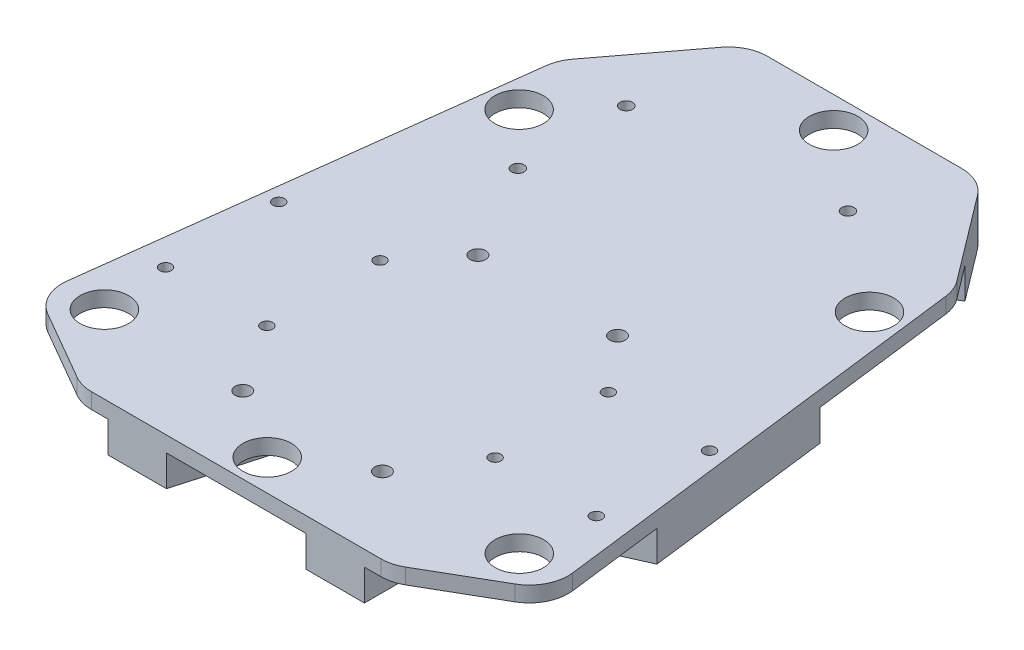
from build123d import *

# Parameters (mm, degrees)
SKETCH1_R           = 6.25
BOSS_EXTRUDE2_DEPTH = 12
SKETCH3_R           = 1.6
SKETCH3_R_2         = 2
SKETCH3_R_3         = 1.5
CUT_EXTRUDE3_DEPTH  = 194.554036966
SKETCH4_R           = 1.6
SKETCH4_R_2         = 6.25
SKETCH4_R_3         = 1.5
CUT_EXTRUDE4_DEPTH  = 8


with BuildPart() as part:
    # Sketch1 → Boss-Extrude2 (new body)
    with BuildSketch(Plane(origin=(0, 0, 0), x_dir=(1, 0, 0), z_dir=(0, 1, 0))):
        with BuildLine():
            Line((2.679491924, 0), (77.320508076, 0))
            ThreePointArc((77.320508076, 0), (79.908698527, 0.340741737), (82.320508076, 1.339745962))
            Line((82.320508076, 1.339745962), (100.238610908, 11.684767456))
            ThreePointArc((100.238610908, 11.684767456), (104.191551765, 15.890265607), (105.162092892, 21.579730085))
            Line((105.162092892, 21.579730085), (91.495098183, 131.422794828))
            ThreePointArc((91.495098183, 131.422794828), (90.837397635, 133.949109284), (89.548249395, 136.219116235))
            Line((89.548249395, 136.219116235), (73.056541302, 158.031029999))
            ThreePointArc((73.056541302, 158.031029999), (69.534663992, 160.952940857), (65.079908105, 162))
            Line((65.079908105, 162), (14.920091895, 162))
            ThreePointArc((14.920091895, 162), (10.465336008, 160.952940857), (6.943458698, 158.031029999))
            Line((6.943458698, 158.031029999), (-9.548249395, 136.219116235))
            ThreePointArc((-9.548249395, 136.219116235), (-10.837397635, 133.949109284), (-11.495098183, 131.422794828))
            Line((-11.495098183, 131.422794828), (-25.162092892, 21.579730085))
            ThreePointArc((-25.162092892, 21.579730085), (-24.191551765, 15.890265607), (-20.238610908, 11.684767456))
            Line((-20.238610908, 11.684767456), (-2.320508076, 1.339745962))
            ThreePointArc((-2.320508076, 1.339745962), (0.091301473, 0.340741737), (2.679491924, 0))
        make_face()
        with Locations(Location((-13.980762114, 20, 0), (0, 0, 270))):
            Circle(SKETCH1_R, mode=Mode.SUBTRACT)
        with Locations(Location((93.980762114, 19, 0), (0, 0, 270))):
            Circle(SKETCH1_R, mode=Mode.SUBTRACT)
        with Locations(Location((-5.164259013, 118.081783812, 0), (0, 0, 270))):
            Circle(SKETCH1_R, mode=Mode.SUBTRACT)
        with Locations(Location((85.164259013, 118.081783812, 0), (0, 0, 270))):
            Circle(SKETCH1_R, mode=Mode.SUBTRACT)
        with Locations(Location((40, 154, 0), (0, 0, 270))):
            Circle(SKETCH1_R, mode=Mode.SUBTRACT)
        with Locations(Location((40, 8, 0), (0, 0, 270))):
            Circle(SKETCH1_R, mode=Mode.SUBTRACT)
    extrude(amount=BOSS_EXTRUDE2_DEPTH)

    # Sketch3 → Cut-Extrude3 (cut, through all)
    with BuildSketch(Plane(origin=(0, 12, 0), x_dir=(1, 0, 0), z_dir=(0, 1, 0))):
        with Locations(Location((7.799462252, 104.803453548, 0), (0, 0, 270))):
            Circle(SKETCH3_R)
        with Locations(Location((7.799462252, 132.743453548, 0), (0, 0, 270))):
            Circle(SKETCH3_R)
        with Locations(Location((59.869462252, 137.823453548, 0), (0, 0, 270))):
            Circle(SKETCH3_R)
        with Locations(Location((58, 19.7, 0), (0, 0, 270))):
            Circle(SKETCH3_R_2)
        with Locations(Location((22, 19.7, 0), (0, 0, 90))):
            Circle(SKETCH3_R_2)
        with Locations(Location((22, 80.3, 0), (0, 0, 270))):
            Circle(SKETCH3_R_2)
        with Locations(Location((58, 80.3, 0), (0, 0, 90))):
            Circle(SKETCH3_R_2)
        with Locations(Location((10.577199901, 37.314321378, 0), (0, 0, 270))):
            Circle(SKETCH3_R_3)
        with Locations(Location((-15.522800099, 66.494321378, 0), (0, 0, 270))):
            Circle(SKETCH3_R_3)
        with Locations(Location((-15.522800099, 37.314321378, 0), (0, 0, 270))):
            Circle(SKETCH3_R_3)
        with Locations(Location((10.577199901, 66.494321378, 0), (0, 0, 270))):
            Circle(SKETCH3_R_3)
        with Locations(Location((95.522800099, 37.314321378, 0), (0, 0, 90))):
            Circle(SKETCH3_R_3)
        with Locations(Location((95.522800099, 66.494321378, 0), (0, 0, 90))):
            Circle(SKETCH3_R_3)
        with Locations(Location((69.422800099, 37.314321378, 0), (0, 0, 90))):
            Circle(SKETCH3_R_3)
        with Locations(Location((69.422800099, 66.494321378, 0), (0, 0, 90))):
            Circle(SKETCH3_R_3)
    extrude(amount=-CUT_EXTRUDE3_DEPTH, mode=Mode.SUBTRACT)

    # Sketch4 → Cut-Extrude4 (cut)
    # profile 1 of 8: a face of its own
    with BuildSketch(Plane.XZ):
        with BuildLine():
            Line((14.920091895, -99.763149928), (-16.111032357, -94.324049484))
            Line((-16.111032357, -94.324049484), (-11.495098183, -131.422794828))
            ThreePointArc((-11.495098183, -131.422794828), (-10.837397635, -133.949109284), (-9.548249395, -136.219116235))
            Line((-9.548249395, -136.219116235), (-3.07018894, -144.786991388))
            Line((-3.07018894, -144.786991388), (14.920091895, -134.081783812))
            Line((14.920091895, -134.081783812), (14.920091895, -99.763149928))
        make_face()
        with Locations(Location((7.799462252, -132.743453548, 0), (0, 0, 90))):
            Circle(SKETCH4_R, mode=Mode.SUBTRACT)
        with Locations(Location((-5.164259013, -118.081783812, 0), (0, 0, 270))):
            Circle(SKETCH4_R_2, mode=Mode.SUBTRACT)
        with Locations(Location((7.799462252, -104.803453548, 0), (0, 0, 90))):
            Circle(SKETCH4_R, mode=Mode.SUBTRACT)
    # profile 2 of 8: a face of its own
    with BuildSketch(Plane.XZ):
        with BuildLine():
            Line((52.588445494, -138.333140663), (40, -138.333140663))
            Line((40, -138.333140663), (40, -147.75))
            ThreePointArc((40, -147.75), (44.419417382, -149.580582618), (46.25, -154))
            ThreePointArc((46.25, -154), (44.419417382, -158.419417382), (40, -160.25))
            Line((40, -160.25), (40, -162))
            Line((40, -162), (57.978215662, -162))
            Line((57.978215662, -162), (52.588445494, -138.333140663))
        make_face()
    # profile 3 of 8: a face of its own
    with BuildSketch(Plane.XZ):
        with BuildLine():
            Line((40, -147.75), (40, -138.333140663))
            Line((40, -138.333140663), (27.411554506, -138.333140663))
            Line((27.411554506, -138.333140663), (22.021784338, -162))
            Line((22.021784338, -162), (40, -162))
            Line((40, -162), (40, -160.25))
            ThreePointArc((40, -160.25), (33.75, -154), (40, -147.75))
        make_face()
    # profile 4 of 8: a face of its own
    with BuildSketch(Plane.XZ):
        with BuildLine():
            Line((91.495098183, -131.422794828), (96.111032357, -94.324049484))
            Line((96.111032357, -94.324049484), (65.079908105, -99.763149928))
            Line((65.079908105, -99.763149928), (65.079908105, -134.081783812))
            Line((65.079908105, -134.081783812), (83.07018894, -144.786991388))
            Line((83.07018894, -144.786991388), (89.548249395, -136.219116235))
            ThreePointArc((89.548249395, -136.219116235), (90.837397635, -133.949109284), (91.495098183, -131.422794828))
        make_face()
        with Locations(Location((85.164259013, -118.081783812, 0), (0, 0, 270))):
            Circle(SKETCH4_R_2, mode=Mode.SUBTRACT)
    # profile 5 of 8: a face of its own
    with BuildSketch(Plane.XZ):
        with BuildLine():
            Line((100.238610908, -11.684767456), (82.320508076, -1.339745962))
            ThreePointArc((82.320508076, -1.339745962), (79.908698527, -0.340741737), (77.320508076, 0))
            Line((77.320508076, 0), (73.056541302, 0))
            Line((73.056541302, 0), (73.056541302, -33.441212659))
            Line((73.056541302, -33.441212659), (102.077468862, -46.371175776))
            Line((102.077468862, -46.371175776), (105.162092892, -21.579730085))
            ThreePointArc((105.162092892, -21.579730085), (104.191551765, -15.890265607), (100.238610908, -11.684767456))
        make_face()
        with Locations(Location((95.522800099, -37.314321378, 0), (0, 0, 270))):
            Circle(SKETCH4_R_3, mode=Mode.SUBTRACT)
        with Locations(Location((93.980762114, -19, 0), (0, 0, 270))):
            Circle(SKETCH4_R_2, mode=Mode.SUBTRACT)
    # profile 6 of 8: a face of its own
    with BuildSketch(Plane.XZ):
        with BuildLine():
            Line((51.192803455, -24.002493724), (57.978215662, 0))
            Line((57.978215662, 0), (40, 0))
            Line((40, 0), (40, -1.75))
            ThreePointArc((40, -1.75), (44.419417382, -3.580582618), (46.25, -8))
            ThreePointArc((46.25, -8), (44.419417382, -12.419417382), (40, -14.25))
            Line((40, -14.25), (40, -24.002493724))
            Line((40, -24.002493724), (51.192803455, -24.002493724))
        make_face()
    # profile 7 of 8: a face of its own
    with BuildSketch(Plane.XZ):
        with BuildLine():
            Line((40, -1.75), (40, 0))
            Line((40, 0), (22.021784338, 0))
            Line((22.021784338, 0), (28.807196545, -24.002493724))
            Line((28.807196545, -24.002493724), (40, -24.002493724))
            Line((40, -24.002493724), (40, -14.25))
            ThreePointArc((40, -14.25), (33.75, -8), (40, -1.75))
        make_face()
    # profile 8 of 8: a face of its own
    with BuildSketch(Plane.XZ):
        with BuildLine():
            Line((6.943458698, -33.441212659), (6.943458698, 0))
            Line((6.943458698, 0), (2.679491924, 0))
            ThreePointArc((2.679491924, 0), (0.091301473, -0.340741737), (-2.320508076, -1.339745962))
            Line((-2.320508076, -1.339745962), (-20.238610908, -11.684767456))
            ThreePointArc((-20.238610908, -11.684767456), (-24.191551765, -15.890265607), (-25.162092892, -21.579730085))
            Line((-25.162092892, -21.579730085), (-22.077468862, -46.371175776))
            Line((-22.077468862, -46.371175776), (6.943458698, -33.441212659))
        make_face()
        with Locations(Location((-15.522800099, -37.314321378, 0), (0, 0, 90))):
            Circle(SKETCH4_R_3, mode=Mode.SUBTRACT)
        with Locations(Location((-13.980762114, -20, 0), (0, 0, 270))):
            Circle(SKETCH4_R_2, mode=Mode.SUBTRACT)
    extrude(amount=-CUT_EXTRUDE4_DEPTH, mode=Mode.SUBTRACT)


solid = part.part
